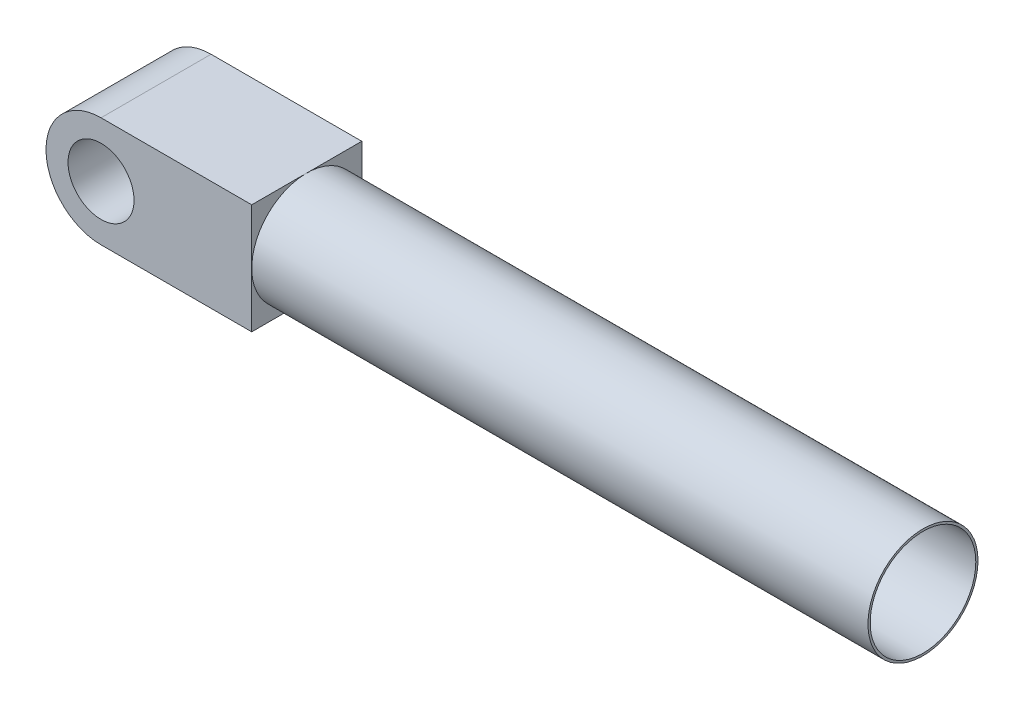
from build123d import *

# Parameters (mm, degrees)
SKETCH_1_R      = 15
EXTRUDE_1_DEPTH = 25
SKETCH_2_R      = 25
SKETCH_2_R_2    = 24
EXTRUDE_2_DEPTH = 280
SCALE_1_SCALE   = 0.6


with BuildPart() as part:
    # 草图1 → 凸台-拉伸1 (new, symmetric)
    with BuildSketch(Plane.XY):
        with BuildLine():
            Line((0, 25), (68.482482698, 25))
            Line((68.482482698, 25), (68.482482698, -25))
            Line((68.482482698, -25), (0, -25))
            ThreePointArc((0, -25), (-25, 0), (0, 25))
        make_face()
        Circle(SKETCH_1_R, mode=Mode.SUBTRACT)
    extrude(amount=EXTRUDE_1_DEPTH, both=True)


with BuildPart() as body_2:
    # 草图2 → 凸台-拉伸2 (new body)
    with BuildSketch(Plane(origin=(68.482482698, 0, 0), x_dir=(0, 0, -1), z_dir=(1, 0, 0))):
        Circle(SKETCH_2_R)
        Circle(SKETCH_2_R_2, mode=Mode.SUBTRACT)
    extrude(amount=EXTRUDE_2_DEPTH)


with BuildPart() as part_1:
    # 缩放比例1: scaled about (0, 0, 0)
    add(part.part.scale(SCALE_1_SCALE))


with BuildPart() as body_2_1:
    # 缩放比例1: scaled about (0, 0, 0)
    add(body_2.part.scale(SCALE_1_SCALE))


solid = Compound([part_1.part, body_2_1.part])
